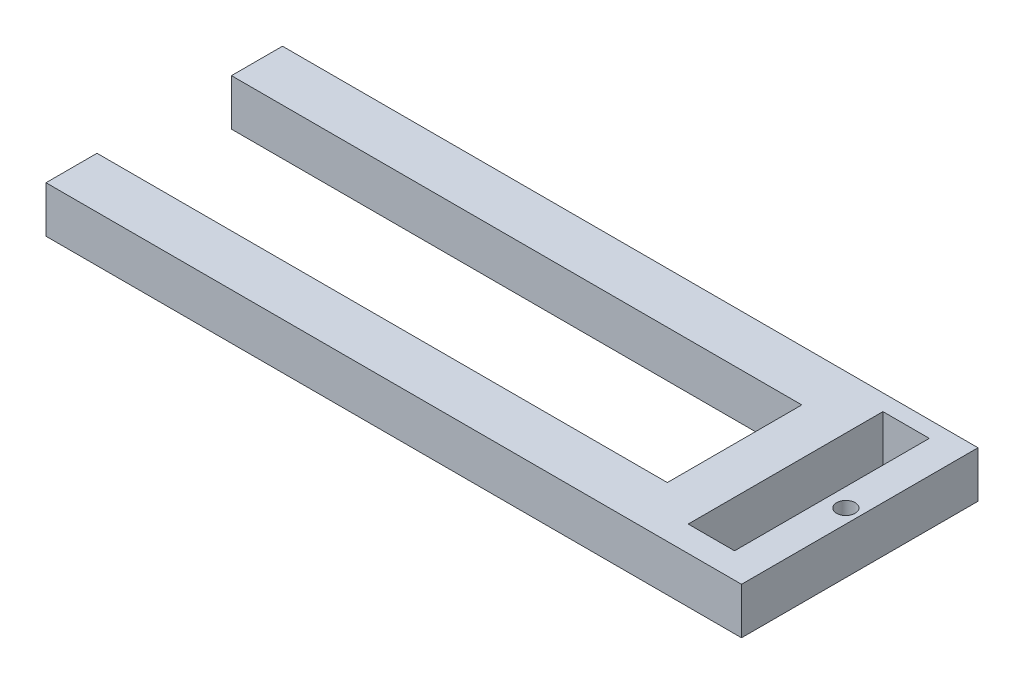
from build123d import *

# Parameters (mm, degrees)
SKETCH1_W           = 150
SKETCH1_H           = 51
BOSS_EXTRUDE1_DEPTH = 10
SKETCH2_W           = 10
SKETCH2_H           = 42
CUT_EXTRUDE1_DEPTH  = 80.845162659
SKETCH3_W           = 123
SKETCH3_H           = 29
CUT_EXTRUDE2_DEPTH  = 80.845162659
SKETCH4_R           = 2
CUT_EXTRUDE3_DEPTH  = 80.845162659


with BuildPart() as part:
    # Sketch1 → Boss-Extrude1 (new body)
    with BuildSketch(Plane(origin=(0, 0, 0), x_dir=(1, 0, 0), z_dir=(0, 1, 0))):
        Rectangle(SKETCH1_W, SKETCH1_H)
    extrude(amount=BOSS_EXTRUDE1_DEPTH)

    # Sketch2 → Cut-Extrude1 (cut, through all)
    with BuildSketch(Plane(origin=(0, 10, 0), x_dir=(1, 0, 0), z_dir=(0, 1, 0))):
        with Locations((63, 1)):
            Rectangle(SKETCH2_W, SKETCH2_H)
    extrude(amount=-CUT_EXTRUDE1_DEPTH, mode=Mode.SUBTRACT)

    # Sketch3 → Cut-Extrude2 (cut, through all)
    with BuildSketch(Plane(origin=(0, 10, 0), x_dir=(1, 0, 0), z_dir=(0, 1, 0))):
        with Locations((-13.5, 0)):
            Rectangle(SKETCH3_W, SKETCH3_H)
    extrude(amount=-CUT_EXTRUDE2_DEPTH, mode=Mode.SUBTRACT)

    # Sketch4 → Cut-Extrude3 (cut, through all)
    with BuildSketch(Plane(origin=(0, 10, 0), x_dir=(1, 0, 0), z_dir=(0, 1, 0))):
        with Locations(Location((72, 0, 0), (0, 0, 270))):
            Circle(SKETCH4_R)
    extrude(amount=-CUT_EXTRUDE3_DEPTH, mode=Mode.SUBTRACT)


solid = part.part
